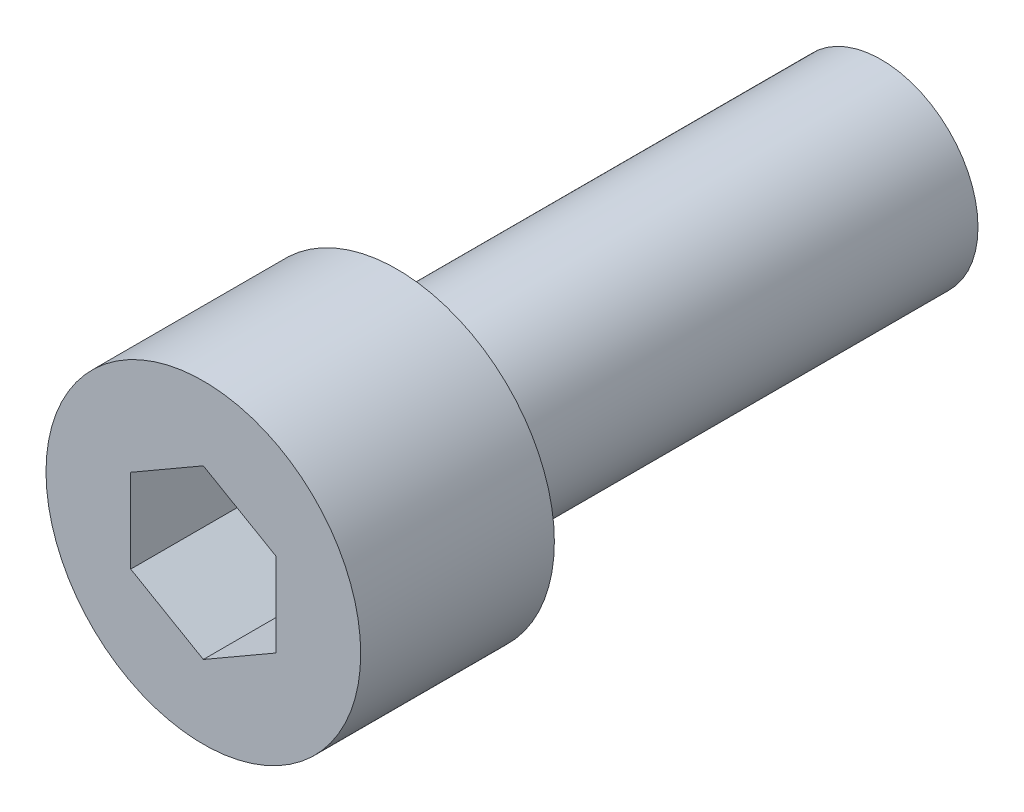
from build123d import *

# Parameters (mm, degrees)
WYTNIJ_WYCI_GNI_CIE1_DEPTH = 6


with BuildPart() as part:
    # Szkic1 → Obrót1 (revolve)
    with BuildSketch(Plane(origin=(0, 0, 0), x_dir=(0, 0, -1), z_dir=(1, 0, 0)), mode=Mode.PRIVATE) as obr_t1_sk:
        Polygon((0, 0), (0, 6.5), (8, 6.5), (8, 4), (28, 4), (28, 0), align=None)
    revolve(obr_t1_sk.sketch.rotate(Axis((0, 0, 0), (0, 0, -1)), 90), axis=Axis((0, 0, 0), (0, 0, -1)))

    # Szkic2 → Wytnij-wyciągnięcie1 (cut)
    with BuildSketch(Plane.XY):
        Polygon((-3, -1.732050808), (0, -3.464101615), (3, -1.732050808), (3, 1.732050808), (0, 3.464101615), (-3, 1.732050808), align=None)
    extrude(amount=-WYTNIJ_WYCI_GNI_CIE1_DEPTH, mode=Mode.SUBTRACT)


solid = part.part
